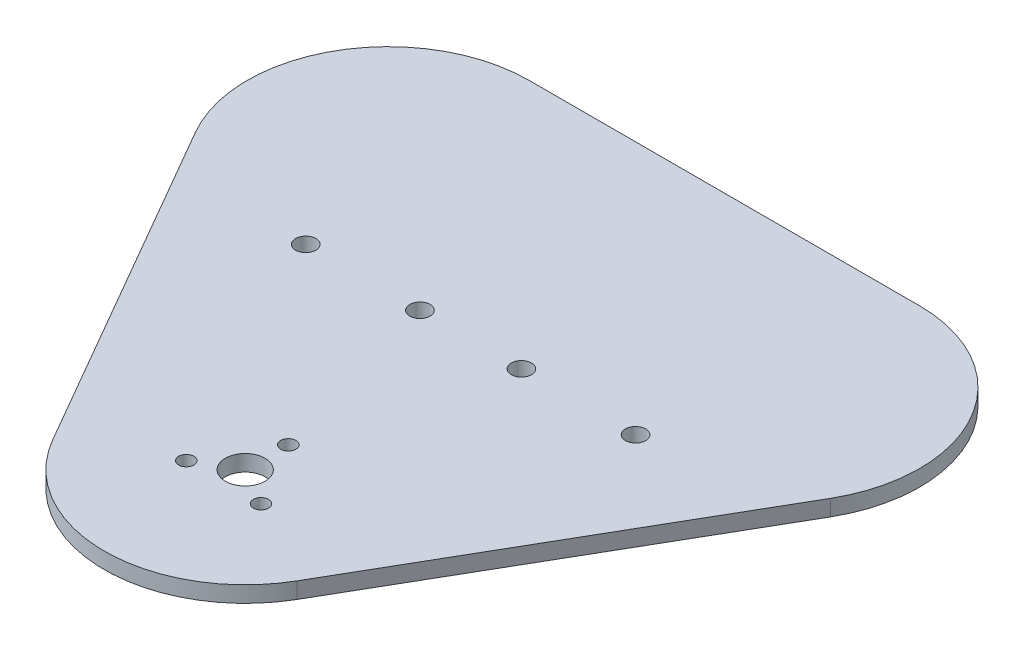
from build123d import *

# Parameters (mm, degrees)
BOSS_EXTRUDE1_DEPTH = 3.175
FILLET1_R           = 27.78
SKETCH5_R           = 2
CUT_EXTRUDE2_DEPTH  = 95.405671522
SKETCH7_R           = 1.5
SKETCH7_R_2         = 3.925
CUT_EXTRUDE3_DEPTH  = 10


with BuildPart() as part:
    # Sketch1 → Boss-Extrude1 (new body)
    with BuildSketch(Plane(origin=(0, 0, 0), x_dir=(1, 0, 0), z_dir=(0, 1, 0))):
        Polygon((0, -94.945058207), (-86.602540378, 55.054941793), (86.602540378, 55.054941793), align=None)
    extrude(amount=BOSS_EXTRUDE1_DEPTH)

    # Fillet1
    fillet1_edges = [part.edges().sort_by_distance(p)[0] for p in [
        (0, 1.5875, 94.945058207),
        (-86.602540378, 1.5875, -55.054941793),
        (86.602540378, 1.5875, -55.054941793),
    ]]
    fillet(fillet1_edges, radius=FILLET1_R)

    # Sketch5 → Cut-Extrude2 (cut, through all)
    with BuildSketch(Plane(origin=(0, 3.175, 0), x_dir=(1, 0, 0), z_dir=(0, 1, 0))):
        with Locations(Location((32.5, 5.054941793, 0), (0, 0, 270))):
            Circle(SKETCH5_R)
        with Locations(Location((-32.5, 5.054941793, 0), (0, 0, 270))):
            Circle(SKETCH5_R)
        with Locations(Location((-10, 5.054941793, 0), (0, 0, 270))):
            Circle(SKETCH5_R)
        with Locations(Location((10, 5.054941793, 0), (0, 0, 270))):
            Circle(SKETCH5_R)
    extrude(amount=-CUT_EXTRUDE2_DEPTH, mode=Mode.SUBTRACT)

    # Sketch7 → Cut-Extrude3 (cut)
    with BuildSketch(Plane(origin=(0, 3.175, 0), x_dir=(1, 0, 0), z_dir=(0, 1, 0))):
        with Locations(Location((0, -30.885058207, 0), (0, 0, 270))):
            Circle(SKETCH7_R)
        with Locations(Location((-7.361215932, -43.635058207, 0), (0, 0, 270))):
            Circle(SKETCH7_R)
        with Locations(Location((0, -39.385058207, 0), (0, 0, 270))):
            Circle(SKETCH7_R_2)
        with Locations(Location((7.361215932, -43.635058207, 0), (0, 0, 270))):
            Circle(SKETCH7_R)
    extrude(amount=-CUT_EXTRUDE3_DEPTH, mode=Mode.SUBTRACT)


solid = part.part
